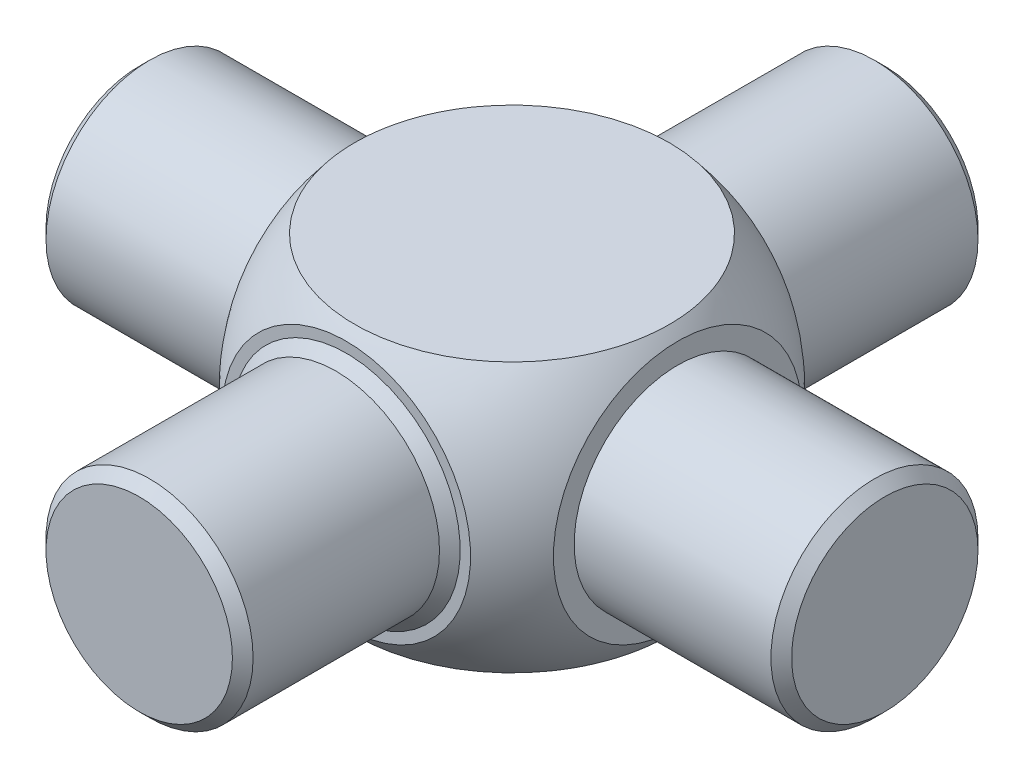
from build123d import *

# Parameters (mm, degrees)
ESQUISSE2_W             = 18
ESQUISSE2_H             = 4.5
ENL_V_MAT_EXTRU_1_DEPTH = 12.5
ESQUISSE3_W             = 18
ESQUISSE3_H             = 3
ENL_V_MAT_EXTRU_2_DEPTH = 12.5
ESQUISSE4_W             = 5
ESQUISSE4_H             = 36
CHANFREIN1_SIZE         = 0.5


with BuildPart() as part:
    # Esquisse1 → Base-Révolution (revolve)
    with BuildSketch(Plane.XY, mode=Mode.PRIVATE) as base_r_volution_sk:
        with BuildLine():
            Line((18, 0), (-18, 0))
            Line((-18, 0), (-18, 5))
            Line((-18, 5), (-8, 5))
            Line((-8, 5), (-8, 6))
            ThreePointArc((-8, 6), (0, 10), (8, 6))
            Line((8, 6), (8, 5))
            Line((8, 5), (18, 5))
            Line((18, 5), (18, 0))
        make_face()
    revolve(base_r_volution_sk.sketch.rotate(Axis((0, 0, 0), (-1, 0, 0)), 90), axis=Axis((0, 0, 0), (-1, 0, 0)))

    # Esquisse2 → Enlèv. mat.-Extru.1 (cut, symmetric)
    with BuildSketch(Plane.XY):
        with Locations((0, 8.75)):
            Rectangle(ESQUISSE2_W, ESQUISSE2_H)
        with Locations((0, -8.75)):
            Rectangle(ESQUISSE2_W, ESQUISSE2_H)
    extrude(amount=ENL_V_MAT_EXTRU_1_DEPTH, both=True, mode=Mode.SUBTRACT)

    # Esquisse3 → Enlèv. mat.-Extru.2 (cut, symmetric)
    with BuildSketch(Plane(origin=(0, 0, 0), x_dir=(1, 0, 0), z_dir=(0, 1, 0))):
        with Locations((0, 9.5)):
            Rectangle(ESQUISSE3_W, ESQUISSE3_H)
        with Locations((0, -9.5)):
            Rectangle(ESQUISSE3_W, ESQUISSE3_H)
    extrude(amount=ENL_V_MAT_EXTRU_2_DEPTH, both=True, mode=Mode.SUBTRACT)

    # Esquisse4 → Boss.-Révol.1 (revolve)
    with BuildSketch(Plane(origin=(0, 0, 0), x_dir=(1, 0, 0), z_dir=(0, 1, 0))):
        with Locations((2.5, 0)):
            Rectangle(ESQUISSE4_W, ESQUISSE4_H)
    revolve(axis=Axis((0, 0, 0), (0, 0, -1)))

    # Chanfrein1
    chanfrein1_edges = [part.edges().sort_by_distance(p)[0] for p in [
        (-18, 0, 5),
        (-5, 0, 8),
        (-5, 0, -18),
        (18, 0, 5),
        (-5, 0, 18),
    ]]
    chamfer(chanfrein1_edges, length=CHANFREIN1_SIZE)


solid = part.part
